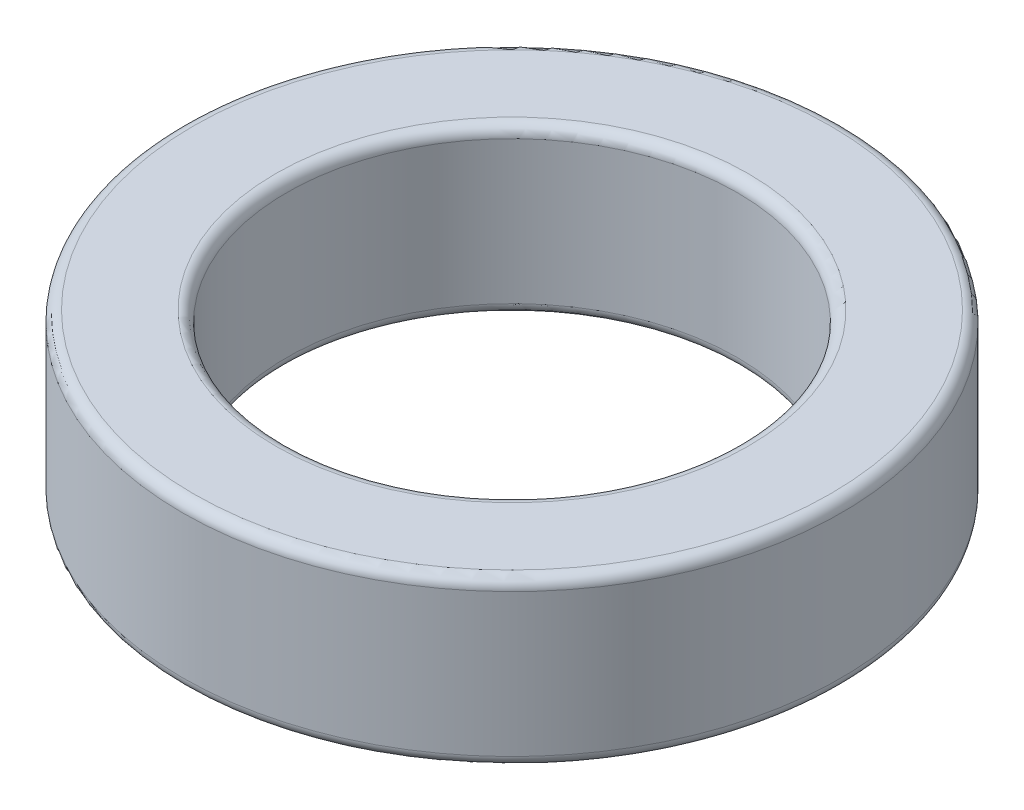
from build123d import *

# Parameters (mm, degrees)
SKETCH1_R           = 3
SKETCH1_R_2         = 2.05
BOSS_EXTRUDE1_DEPTH = 0.75
FILLET1_R           = 0.1


with BuildPart() as part:
    # Sketch1 → Boss-Extrude1 (new, symmetric)
    with BuildSketch(Plane(origin=(0, 0, 0), x_dir=(1, 0, 0), z_dir=(0, 1, 0))):
        with Locations(Location((0, 0, 0), (0, 0, 270))):
            Circle(SKETCH1_R)
        with Locations(Location((0, 0, 0), (0, 0, 270))):
            Circle(SKETCH1_R_2, mode=Mode.SUBTRACT)
    extrude(amount=BOSS_EXTRUDE1_DEPTH, both=True)

    # Fillet1
    fillet1_edges = [part.edges().sort_by_distance(p)[0] for p in [
        (0, -0.75, -3),
        (0, 0.75, -3),
        (0, -0.75, -2.05),
        (0, 0.75, -2.05),
    ]]
    fillet(fillet1_edges, radius=FILLET1_R)


solid = part.part
